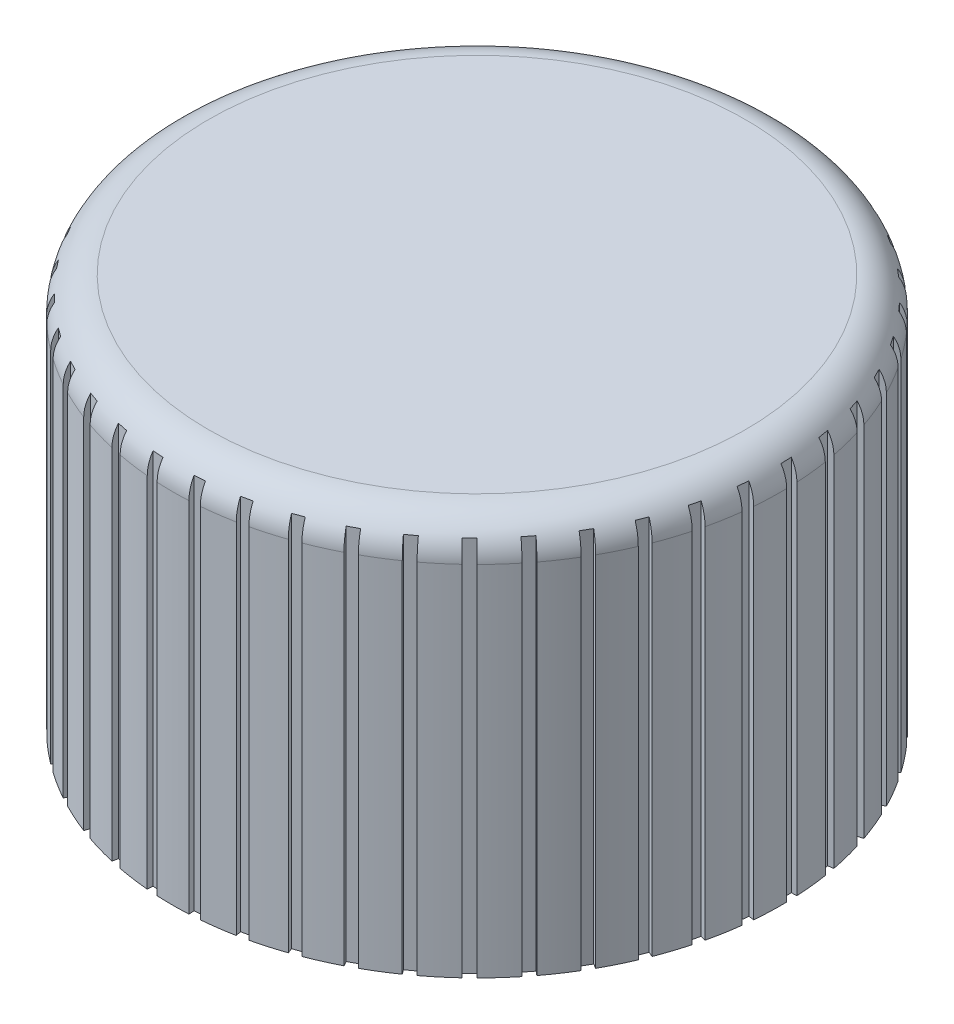
from build123d import *

# Parameters (mm, degrees)
SKETCH_1_R          = 8.5
EXTRUDE_1_DEPTH     = 11
SKETCH_2_R          = 2.95
CUT_EXTRUDE_1_DEPTH = 8.8
FILLET_1_R          = 1
CUT_EXTRUDE_2_DEPTH = 9
CUT_EXTRUDE_3_DEPTH = 17.294170789


with BuildPart() as part:
    # 草图1 → 凸台-拉伸1 (new body)
    with BuildSketch(Plane(origin=(0, 0, 0), x_dir=(1, 0, 0), z_dir=(0, 1, 0))):
        with Locations(Location((0, 0, 0), (0, 0, 270))):
            Circle(SKETCH_1_R)
    extrude(amount=EXTRUDE_1_DEPTH)

    # 草图2 → 切除-拉伸1 (cut)
    with BuildSketch(Plane.XZ):
        with Locations(Location((0, 0, 0), (0, 0, 270))):
            Circle(SKETCH_2_R)
    extrude(amount=-CUT_EXTRUDE_1_DEPTH, mode=Mode.SUBTRACT)

    # 圆角1
    fillet_1_edges = [part.edges().sort_by_distance(p)[0] for p in [
        (0, 11, -8.5),
    ]]
    fillet(fillet_1_edges, radius=FILLET_1_R)

    # 草图3 → 切除-拉伸2 (cut)
    with BuildSketch(Plane.XZ):
        with BuildLine():
            Line((4.742640687, 1.583464339), (6.5, 2.598076211))
            ThreePointArc((6.5, 2.598076211), (7, 0), (6.5, -2.598076211))
            Line((6.5, -2.598076211), (4.742640687, -1.583464339))
            ThreePointArc((4.742640687, -1.583464339), (5, 0), (4.742640687, 1.583464339))
        make_face()
        with BuildLine():
            Line((1, 4.898979486), (1, 6.92820323))
            ThreePointArc((1, 6.92820323), (3.5, 6.062177826), (5.5, 4.330127019))
            Line((5.5, 4.330127019), (3.742640687, 3.315515147))
            ThreePointArc((3.742640687, 3.315515147), (2.5, 4.330127019), (1, 4.898979486))
        make_face()
        with BuildLine():
            Line((-1, 4.898979486), (-1, 6.92820323))
            ThreePointArc((-1, 6.92820323), (-3.5, 6.062177826), (-5.5, 4.330127019))
            Line((-5.5, 4.330127019), (-3.742640687, 3.315515147))
            ThreePointArc((-3.742640687, 3.315515147), (-2.5, 4.330127019), (-1, 4.898979486))
        make_face()
        with BuildLine():
            Line((3.742640687, -3.315515147), (5.5, -4.330127019))
            ThreePointArc((5.5, -4.330127019), (3.5, -6.062177826), (1, -6.92820323))
            Line((1, -6.92820323), (1, -4.898979486))
            ThreePointArc((1, -4.898979486), (2.5, -4.330127019), (3.742640687, -3.315515147))
        make_face()
        with BuildLine():
            Line((-1, -4.898979486), (-1, -6.92820323))
            ThreePointArc((-1, -6.92820323), (-3.5, -6.062177826), (-5.5, -4.330127019))
            Line((-5.5, -4.330127019), (-3.742640687, -3.315515147))
            ThreePointArc((-3.742640687, -3.315515147), (-2.5, -4.330127019), (-1, -4.898979486))
        make_face()
        with BuildLine():
            Line((-4.742640687, -1.583464339), (-6.5, -2.598076211))
            ThreePointArc((-6.5, -2.598076211), (-7, 0), (-6.5, 2.598076211))
            Line((-6.5, 2.598076211), (-4.742640687, 1.583464339))
            ThreePointArc((-4.742640687, 1.583464339), (-5, 0), (-4.742640687, -1.583464339))
        make_face()
    extrude(amount=-CUT_EXTRUDE_2_DEPTH, mode=Mode.SUBTRACT)

    # 草图5 → 切除-拉伸3 (cut, through all)
    with BuildSketch(Plane(origin=(0, 11, 0), x_dir=(1, 0, 0), z_dir=(0, 1, 0))):
        with BuildLine():
            Line((1.161503152, 8.264524357), (1.013193467, 8.285367924))
            Line((1.013193467, 8.285367924), (1.035889419, 8.436642289))
            ThreePointArc((1.035889419, 8.436642289), (1.182971358, 8.417278584), (1.329692953, 8.395350895))
            Line((1.329692953, 8.395350895), (1.309812836, 8.24368079))
            Line((1.309812836, 8.24368079), (1.161503152, 8.264524357))
        make_face()
        with BuildLine():
            Line((0, 8.345744569), (-0.149767209, 8.345744569))
            Line((-0.149767209, 8.345744569), (-0.148345455, 8.498705409))
            ThreePointArc((-0.148345455, 8.498705409), (0, 8.5), (0.148345455, 8.498705409))
            Line((0.148345455, 8.498705409), (0.149767209, 8.345744569))
            Line((0.149767209, 8.345744569), (0, 8.345744569))
        make_face()
        with BuildLine():
            Line((2.300398965, 8.022444579), (2.156433484, 8.063726016))
            Line((2.156433484, 8.063726016), (2.199961883, 8.210369523))
            ThreePointArc((2.199961883, 8.210369523), (2.342917524, 8.170724415), (2.48515949, 8.128590426))
            Line((2.48515949, 8.128590426), (2.444364446, 7.981163141))
            Line((2.444364446, 7.981163141), (2.300398965, 8.022444579))
        make_face()
        with BuildLine():
            Line((3.39452013, 7.624217042), (3.257700977, 7.685132854))
            Line((3.257700977, 7.685132854), (3.321214592, 7.824291254))
            ThreePointArc((3.321214592, 7.824291254), (3.457261466, 7.76513639), (3.592255225, 7.70361619))
            Line((3.592255225, 7.70361619), (3.531339283, 7.56330123))
            Line((3.531339283, 7.56330123), (3.39452013, 7.624217042))
        make_face()
        with BuildLine():
            Line((4.422570822, 7.077592793), (4.295561025, 7.156957322))
            Line((4.295561025, 7.156957322), (4.377823637, 7.285922056))
            ThreePointArc((4.377823637, 7.285922056), (4.504313746, 7.208408817), (4.629431798, 7.128699828))
            Line((4.629431798, 7.128699828), (4.549580618, 6.998228264))
            Line((4.549580618, 6.998228264), (4.422570822, 7.077592793))
        make_face()
        with BuildLine():
            Line((5.364541203, 6.393211251), (5.249812865, 6.489479757))
            Line((5.249812865, 6.489479757), (5.349223324, 6.605740672))
            ThreePointArc((5.349223324, 6.605740672), (5.463694682, 6.511377767), (5.576501746, 6.415031432))
            Line((5.576501746, 6.415031432), (5.479269541, 6.296942745))
            Line((5.479269541, 6.296942745), (5.364541203, 6.393211251))
        make_face()
        with BuildLine():
            Line((6.202096891, 5.584393124), (6.101883068, 5.69569185))
            Line((6.101883068, 5.69569185), (6.216506464, 5.796986061))
            ThreePointArc((6.216506464, 5.796986061), (6.316731017, 5.687610154), (6.415031432, 5.576501746))
            Line((6.415031432, 5.576501746), (6.302310715, 5.473094398))
            Line((6.302310715, 5.473094398), (6.202096891, 5.584393124))
        make_face()
        with BuildLine():
            Line((6.918935819, 4.666881137), (6.835187059, 4.79104378))
            Line((6.835187059, 4.79104378), (6.962792376, 4.875399709))
            ThreePointArc((6.962792376, 4.875399709), (7.046819367, 4.75313968), (7.128699828, 4.629431798))
            Line((7.128699828, 4.629431798), (7.002684579, 4.542718494))
            Line((7.002684579, 4.542718494), (6.918935819, 4.666881137))
        make_face()
        with BuildLine():
            Line((7.501105531, 3.658533618), (7.435451908, 3.793143493))
            Line((7.435451908, 3.793143493), (7.573555456, 3.858919248))
            ThreePointArc((7.573555456, 3.858919248), (7.639749394, 3.726154748), (7.70361619, 3.592255225))
            Line((7.70361619, 3.592255225), (7.566759154, 3.523923742))
            Line((7.566759154, 3.523923742), (7.501105531, 3.658533618))
        make_face()
        with BuildLine():
            Line((7.937274756, 2.578976903), (7.890994143, 2.721413982))
            Line((7.890994143, 2.721413982), (8.036907893, 2.767329313))
            ThreePointArc((8.036907893, 2.767329313), (8.083980389, 2.626644452), (8.128590426, 2.48515949))
            Line((8.128590426, 2.48515949), (7.983555369, 2.436539823))
            Line((7.983555369, 2.436539823), (7.937274756, 2.578976903))
        make_face()
        with BuildLine():
            Line((8.218953956, 1.449223336), (8.192947154, 1.596715244))
            Line((8.192947154, 1.596715244), (8.343831059, 1.621876461))
            ThreePointArc((8.343831059, 1.621876461), (8.370865901, 1.47600951), (8.395350895, 1.329692953))
            Line((8.395350895, 1.329692953), (8.244960759, 1.301731427))
            Line((8.244960759, 1.301731427), (8.218953956, 1.449223336))
        make_face()
        with BuildLine():
            Line((8.340660567, 0.291262285), (8.335433767, 0.44093826))
            Line((8.335433767, 0.44093826), (8.488351045, 0.444855628))
            ThreePointArc((8.488351045, 0.444855628), (8.49482203, 0.296645722), (8.498705409, 0.148345455))
            Line((8.498705409, 0.148345455), (8.345887367, 0.141586311))
            Line((8.345887367, 0.141586311), (8.340660567, 0.291262285))
        make_face()
        with BuildLine():
            Line((8.300025707, -0.872367855), (8.315680643, -0.723421086))
            Line((8.315680643, -0.723421086), (8.467654934, -0.740823813))
            ThreePointArc((8.467654934, -0.740823813), (8.453436111, -0.888491938), (8.436642289, -1.035889419))
            Line((8.436642289, -1.035889419), (8.284370771, -1.021314623))
            Line((8.284370771, -1.021314623), (8.300025707, -0.872367855))
        make_face()
        with BuildLine():
            Line((8.097840288, -2.019018346), (8.134072255, -1.873699864))
            Line((8.134072255, -1.873699864), (8.282145551, -1.912083962))
            ThreePointArc((8.282145551, -1.912083962), (8.247513673, -2.056336113), (8.210369523, -2.199961883))
            Line((8.210369523, -2.199961883), (8.061608321, -2.164336829))
            Line((8.061608321, -2.164336829), (8.097840288, -2.019018346))
        make_face()
        with BuildLine():
            Line((7.738039619, -3.126370943), (7.794143403, -2.987509205))
            Line((7.794143403, -2.987509205), (7.935433625, -3.046127571))
            ThreePointArc((7.935433625, -3.046127571), (7.881062764, -3.184156044), (7.824291254, -3.321214592))
            Line((7.824291254, -3.321214592), (7.681935835, -3.26523268))
            Line((7.681935835, -3.26523268), (7.738039619, -3.126370943))
        make_face()
        with BuildLine():
            Line((7.22762681, -4.172872285), (7.302510415, -4.043170077))
            Line((7.302510415, -4.043170077), (7.434267511, -4.120881772))
            ThreePointArc((7.434267511, -4.120881772), (7.361215932, -4.25), (7.285922056, -4.377823637))
            Line((7.285922056, -4.377823637), (7.152743206, -4.302574492))
            Line((7.152743206, -4.302574492), (7.22762681, -4.172872285))
        make_face()
        with BuildLine():
            Line((6.576536467, -5.138153414), (6.668742368, -5.020135243))
            Line((6.668742368, -5.020135243), (6.788401835, -5.115427697))
            ThreePointArc((6.788401835, -5.115427697), (6.698091406, -5.23312254), (6.605740672, -5.349223324))
            Line((6.605740672, -5.349223324), (6.484330567, -5.256171585))
            Line((6.484330567, -5.256171585), (6.576536467, -5.138153414))
        make_face()
        with BuildLine():
            Line((5.797441323, -6.003426232), (5.905174837, -5.899389187))
            Line((5.905174837, -5.899389187), (6.01040764, -6.01040764))
            ThreePointArc((6.01040764, -6.01040764), (5.904596149, -6.114388303), (5.796986061, -6.216506464))
            Line((5.796986061, -6.216506464), (5.689707809, -6.107463277))
            Line((5.689707809, -6.107463277), (5.797441323, -6.003426232))
        make_face()
        with BuildLine():
            Line((4.905505577, -6.751849187), (5.026669794, -6.663818231))
            Line((5.026669794, -6.663818231), (5.115427697, -6.788401835))
            ThreePointArc((5.115427697, -6.788401835), (4.996174644, -6.876644452), (4.875399709, -6.962792376))
            Line((4.875399709, -6.962792376), (4.78434136, -6.839880144))
            Line((4.78434136, -6.839880144), (4.905505577, -6.751849187))
        make_face()
        with BuildLine():
            Line((3.918089746, -7.368855078), (4.050326342, -7.298543633))
            Line((4.050326342, -7.298543633), (4.120881772, -7.434267511))
            ThreePointArc((4.120881772, -7.434267511), (3.990508284, -7.505054539), (3.858919248, -7.573555456))
            Line((3.858919248, -7.573555456), (3.785853149, -7.439166524))
            Line((3.785853149, -7.439166524), (3.918089746, -7.368855078))
        make_face()
        with BuildLine():
            Line((2.854412754, -7.842434587), (2.995147895, -7.791211185))
            Line((2.995147895, -7.791211185), (3.046127571, -7.935433625))
            ThreePointArc((3.046127571, -7.935433625), (2.907171218, -7.987387277), (2.767329313, -8.036907893))
            Line((2.767329313, -8.036907893), (2.713677613, -7.893657989))
            Line((2.713677613, -7.893657989), (2.854412754, -7.842434587))
        make_face()
        with BuildLine():
            Line((1.735177865, -8.163370027), (1.8816723, -8.132231673))
            Line((1.8816723, -8.132231673), (1.912083962, -8.282145551))
            ThreePointArc((1.912083962, -8.282145551), (1.767249372, -8.314254606), (1.621876461, -8.343831059))
            Line((1.621876461, -8.343831059), (1.588683429, -8.19450838))
            Line((1.588683429, -8.19450838), (1.735177865, -8.163370027))
        make_face()
        with BuildLine():
            Line((0.582169712, -8.325414755), (0.731572095, -8.314967523))
            Line((0.731572095, -8.314967523), (0.740823813, -8.467654934))
            ThreePointArc((0.740823813, -8.467654934), (0.592930027, -8.479294427), (0.444855628, -8.488351045))
            Line((0.444855628, -8.488351045), (0.432767329, -8.335861987))
            Line((0.432767329, -8.335861987), (0.582169712, -8.325414755))
        make_face()
        with BuildLine():
            Line((-0.582169712, -8.325414755), (-0.432767329, -8.335861987))
            Line((-0.432767329, -8.335861987), (-0.444855628, -8.488351045))
            ThreePointArc((-0.444855628, -8.488351045), (-0.592930027, -8.479294427), (-0.740823813, -8.467654934))
            Line((-0.740823813, -8.467654934), (-0.731572095, -8.314967523))
            Line((-0.731572095, -8.314967523), (-0.582169712, -8.325414755))
        make_face()
        with BuildLine():
            Line((-1.735177865, -8.163370027), (-1.588683429, -8.19450838))
            Line((-1.588683429, -8.19450838), (-1.621876461, -8.343831059))
            ThreePointArc((-1.621876461, -8.343831059), (-1.767249372, -8.314254606), (-1.912083962, -8.282145551))
            Line((-1.912083962, -8.282145551), (-1.8816723, -8.132231673))
            Line((-1.8816723, -8.132231673), (-1.735177865, -8.163370027))
        make_face()
        with BuildLine():
            Line((-2.854412754, -7.842434587), (-2.713677613, -7.893657989))
            Line((-2.713677613, -7.893657989), (-2.767329313, -8.036907893))
            ThreePointArc((-2.767329313, -8.036907893), (-2.907171218, -7.987387277), (-3.046127571, -7.935433625))
            Line((-3.046127571, -7.935433625), (-2.995147895, -7.791211185))
            Line((-2.995147895, -7.791211185), (-2.854412754, -7.842434587))
        make_face()
        with BuildLine():
            Line((-3.918089746, -7.368855078), (-3.785853149, -7.439166524))
            Line((-3.785853149, -7.439166524), (-3.858919248, -7.573555456))
            ThreePointArc((-3.858919248, -7.573555456), (-3.990508284, -7.505054539), (-4.120881772, -7.434267511))
            Line((-4.120881772, -7.434267511), (-4.050326342, -7.298543633))
            Line((-4.050326342, -7.298543633), (-3.918089746, -7.368855078))
        make_face()
        with BuildLine():
            Line((-4.905505577, -6.751849187), (-4.78434136, -6.839880144))
            Line((-4.78434136, -6.839880144), (-4.875399709, -6.962792376))
            ThreePointArc((-4.875399709, -6.962792376), (-4.996174644, -6.876644452), (-5.115427697, -6.788401835))
            Line((-5.115427697, -6.788401835), (-5.026669794, -6.663818231))
            Line((-5.026669794, -6.663818231), (-4.905505577, -6.751849187))
        make_face()
        with BuildLine():
            Line((-5.797441323, -6.003426232), (-5.689707809, -6.107463277))
            Line((-5.689707809, -6.107463277), (-5.796986061, -6.216506464))
            ThreePointArc((-5.796986061, -6.216506464), (-5.904596149, -6.114388303), (-6.01040764, -6.01040764))
            Line((-6.01040764, -6.01040764), (-5.905174837, -5.899389187))
            Line((-5.905174837, -5.899389187), (-5.797441323, -6.003426232))
        make_face()
        with BuildLine():
            Line((-6.576536467, -5.138153414), (-6.484330567, -5.256171585))
            Line((-6.484330567, -5.256171585), (-6.605740672, -5.349223324))
            ThreePointArc((-6.605740672, -5.349223324), (-6.698091406, -5.23312254), (-6.788401835, -5.115427697))
            Line((-6.788401835, -5.115427697), (-6.668742368, -5.020135243))
            Line((-6.668742368, -5.020135243), (-6.576536467, -5.138153414))
        make_face()
        with BuildLine():
            Line((-7.22762681, -4.172872285), (-7.152743206, -4.302574492))
            Line((-7.152743206, -4.302574492), (-7.285922056, -4.377823637))
            ThreePointArc((-7.285922056, -4.377823637), (-7.361215932, -4.25), (-7.434267511, -4.120881772))
            Line((-7.434267511, -4.120881772), (-7.302510415, -4.043170077))
            Line((-7.302510415, -4.043170077), (-7.22762681, -4.172872285))
        make_face()
        with BuildLine():
            Line((-7.738039619, -3.126370943), (-7.681935835, -3.26523268))
            Line((-7.681935835, -3.26523268), (-7.824291254, -3.321214592))
            ThreePointArc((-7.824291254, -3.321214592), (-7.881062764, -3.184156044), (-7.935433625, -3.046127571))
            Line((-7.935433625, -3.046127571), (-7.794143403, -2.987509205))
            Line((-7.794143403, -2.987509205), (-7.738039619, -3.126370943))
        make_face()
        with BuildLine():
            Line((-8.097840288, -2.019018346), (-8.061608321, -2.164336829))
            Line((-8.061608321, -2.164336829), (-8.210369523, -2.199961883))
            ThreePointArc((-8.210369523, -2.199961883), (-8.247513673, -2.056336113), (-8.282145551, -1.912083962))
            Line((-8.282145551, -1.912083962), (-8.134072255, -1.873699864))
            Line((-8.134072255, -1.873699864), (-8.097840288, -2.019018346))
        make_face()
        with BuildLine():
            Line((-8.300025707, -0.872367855), (-8.284370771, -1.021314623))
            Line((-8.284370771, -1.021314623), (-8.436642289, -1.035889419))
            ThreePointArc((-8.436642289, -1.035889419), (-8.453436111, -0.888491938), (-8.467654934, -0.740823813))
            Line((-8.467654934, -0.740823813), (-8.315680643, -0.723421086))
            Line((-8.315680643, -0.723421086), (-8.300025707, -0.872367855))
        make_face()
        with BuildLine():
            Line((-8.340660567, 0.291262285), (-8.345887367, 0.141586311))
            Line((-8.345887367, 0.141586311), (-8.498705409, 0.148345455))
            ThreePointArc((-8.498705409, 0.148345455), (-8.49482203, 0.296645722), (-8.488351045, 0.444855628))
            Line((-8.488351045, 0.444855628), (-8.335433767, 0.44093826))
            Line((-8.335433767, 0.44093826), (-8.340660567, 0.291262285))
        make_face()
        with BuildLine():
            Line((-8.218953956, 1.449223336), (-8.244960759, 1.301731427))
            Line((-8.244960759, 1.301731427), (-8.395350895, 1.329692953))
            ThreePointArc((-8.395350895, 1.329692953), (-8.370865901, 1.47600951), (-8.343831059, 1.621876461))
            Line((-8.343831059, 1.621876461), (-8.192947154, 1.596715244))
            Line((-8.192947154, 1.596715244), (-8.218953956, 1.449223336))
        make_face()
        with BuildLine():
            Line((-7.937274756, 2.578976903), (-7.983555369, 2.436539823))
            Line((-7.983555369, 2.436539823), (-8.128590426, 2.48515949))
            ThreePointArc((-8.128590426, 2.48515949), (-8.083980389, 2.626644452), (-8.036907893, 2.767329313))
            Line((-8.036907893, 2.767329313), (-7.890994143, 2.721413982))
            Line((-7.890994143, 2.721413982), (-7.937274756, 2.578976903))
        make_face()
        with BuildLine():
            Line((-7.501105531, 3.658533618), (-7.566759154, 3.523923742))
            Line((-7.566759154, 3.523923742), (-7.70361619, 3.592255225))
            ThreePointArc((-7.70361619, 3.592255225), (-7.639749394, 3.726154748), (-7.573555456, 3.858919248))
            Line((-7.573555456, 3.858919248), (-7.435451908, 3.793143493))
            Line((-7.435451908, 3.793143493), (-7.501105531, 3.658533618))
        make_face()
        with BuildLine():
            Line((-6.918935819, 4.666881137), (-7.002684579, 4.542718494))
            Line((-7.002684579, 4.542718494), (-7.128699828, 4.629431798))
            ThreePointArc((-7.128699828, 4.629431798), (-7.046819367, 4.75313968), (-6.962792376, 4.875399709))
            Line((-6.962792376, 4.875399709), (-6.835187059, 4.79104378))
            Line((-6.835187059, 4.79104378), (-6.918935819, 4.666881137))
        make_face()
        with BuildLine():
            Line((-6.202096891, 5.584393124), (-6.302310715, 5.473094398))
            Line((-6.302310715, 5.473094398), (-6.415031432, 5.576501746))
            ThreePointArc((-6.415031432, 5.576501746), (-6.316731017, 5.687610154), (-6.216506464, 5.796986061))
            Line((-6.216506464, 5.796986061), (-6.101883068, 5.69569185))
            Line((-6.101883068, 5.69569185), (-6.202096891, 5.584393124))
        make_face()
        with BuildLine():
            Line((-5.364541203, 6.393211251), (-5.479269541, 6.296942745))
            Line((-5.479269541, 6.296942745), (-5.576501746, 6.415031432))
            ThreePointArc((-5.576501746, 6.415031432), (-5.463694682, 6.511377767), (-5.349223324, 6.605740672))
            Line((-5.349223324, 6.605740672), (-5.249812865, 6.489479757))
            Line((-5.249812865, 6.489479757), (-5.364541203, 6.393211251))
        make_face()
        with BuildLine():
            Line((-4.422570822, 7.077592793), (-4.549580618, 6.998228264))
            Line((-4.549580618, 6.998228264), (-4.629431798, 7.128699828))
            ThreePointArc((-4.629431798, 7.128699828), (-4.504313746, 7.208408817), (-4.377823637, 7.285922056))
            Line((-4.377823637, 7.285922056), (-4.295561025, 7.156957322))
            Line((-4.295561025, 7.156957322), (-4.422570822, 7.077592793))
        make_face()
        with BuildLine():
            Line((-3.39452013, 7.624217042), (-3.531339283, 7.56330123))
            Line((-3.531339283, 7.56330123), (-3.592255225, 7.70361619))
            ThreePointArc((-3.592255225, 7.70361619), (-3.457261466, 7.76513639), (-3.321214592, 7.824291254))
            Line((-3.321214592, 7.824291254), (-3.257700977, 7.685132854))
            Line((-3.257700977, 7.685132854), (-3.39452013, 7.624217042))
        make_face()
        with BuildLine():
            Line((-2.300398965, 8.022444579), (-2.444364446, 7.981163141))
            Line((-2.444364446, 7.981163141), (-2.48515949, 8.128590426))
            ThreePointArc((-2.48515949, 8.128590426), (-2.342917524, 8.170724415), (-2.199961883, 8.210369523))
            Line((-2.199961883, 8.210369523), (-2.156433484, 8.063726016))
            Line((-2.156433484, 8.063726016), (-2.300398965, 8.022444579))
        make_face()
        with BuildLine():
            Line((-1.161503152, 8.264524357), (-1.309812836, 8.24368079))
            Line((-1.309812836, 8.24368079), (-1.329692953, 8.395350895))
            ThreePointArc((-1.329692953, 8.395350895), (-1.182971358, 8.417278584), (-1.035889419, 8.436642289))
            Line((-1.035889419, 8.436642289), (-1.013193467, 8.285367924))
            Line((-1.013193467, 8.285367924), (-1.161503152, 8.264524357))
        make_face()
    extrude(amount=-CUT_EXTRUDE_3_DEPTH, mode=Mode.SUBTRACT)


solid = part.part
